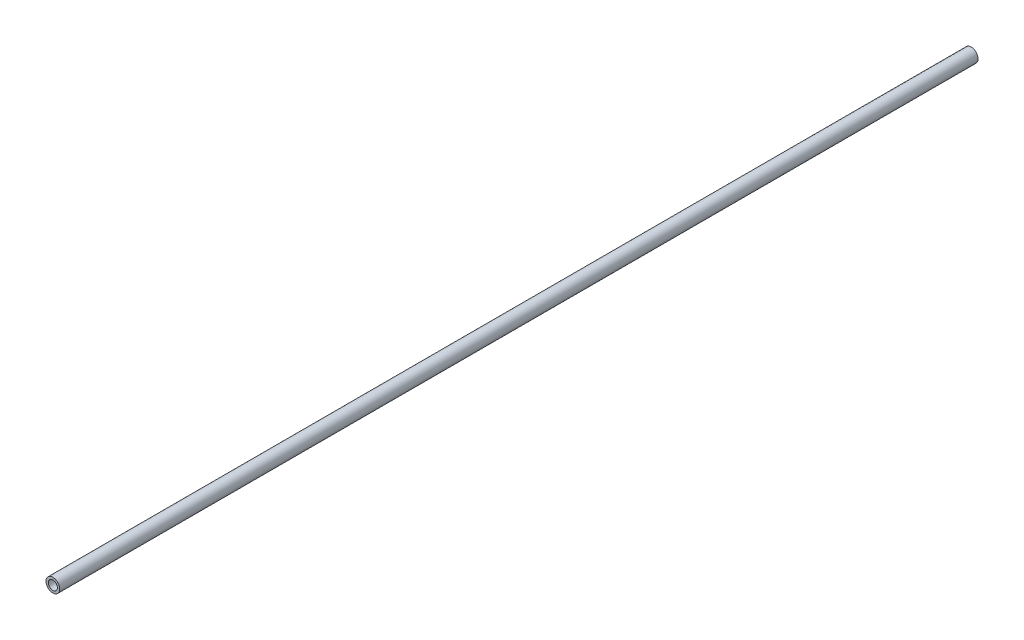
from build123d import *

# Parameters (mm, degrees)
SKETCH3_R           = 9.525
SKETCH3_R_2         = 6.35
BOSS_EXTRUDE1_DEPTH = 1282.7


with BuildPart() as part:
    # Sketch3 → Boss-Extrude1 (new body)
    with BuildSketch(Plane.XY):
        with Locations(Location((0, 0, 0), (0, 0, 180))):
            Circle(SKETCH3_R)
        with Locations(Location((0, 0, 0), (0, 0, 180))):
            Circle(SKETCH3_R_2, mode=Mode.SUBTRACT)
    extrude(amount=BOSS_EXTRUDE1_DEPTH)


solid = part.part
